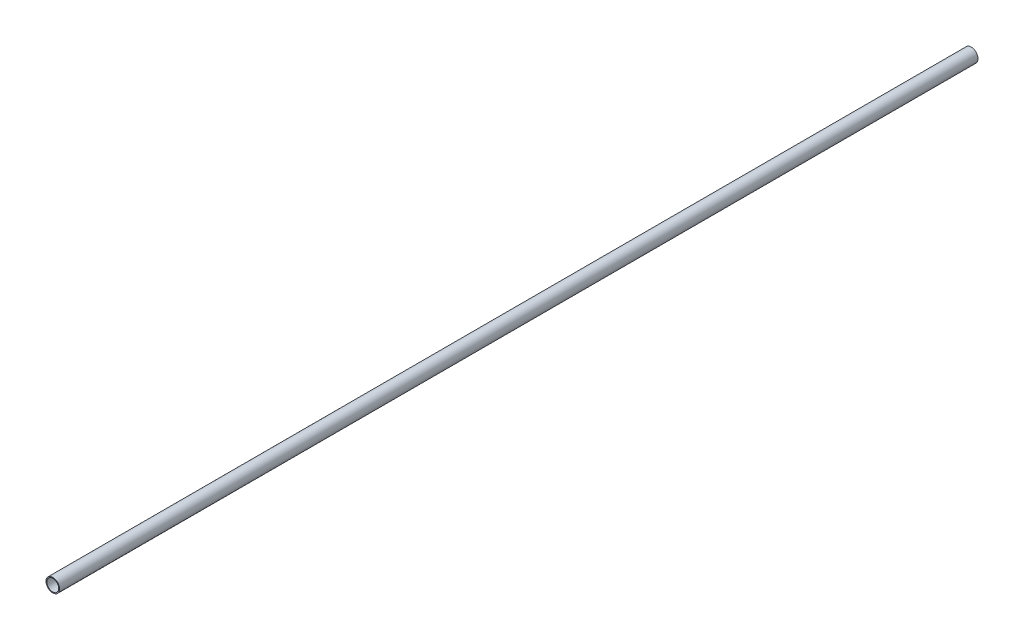
from build123d import *

# Parameters (mm, degrees)
SKETCH1_R           = 8.0264
SKETCH1_R_2         = 7.0104
BOSS_EXTRUDE1_DEPTH = 1085.85


with BuildPart() as part:
    # Sketch1 → Boss-Extrude1 (new body)
    with BuildSketch(Plane.XY):
        Circle(SKETCH1_R)
        Circle(SKETCH1_R_2, mode=Mode.SUBTRACT)
    extrude(amount=BOSS_EXTRUDE1_DEPTH)


solid = part.part
